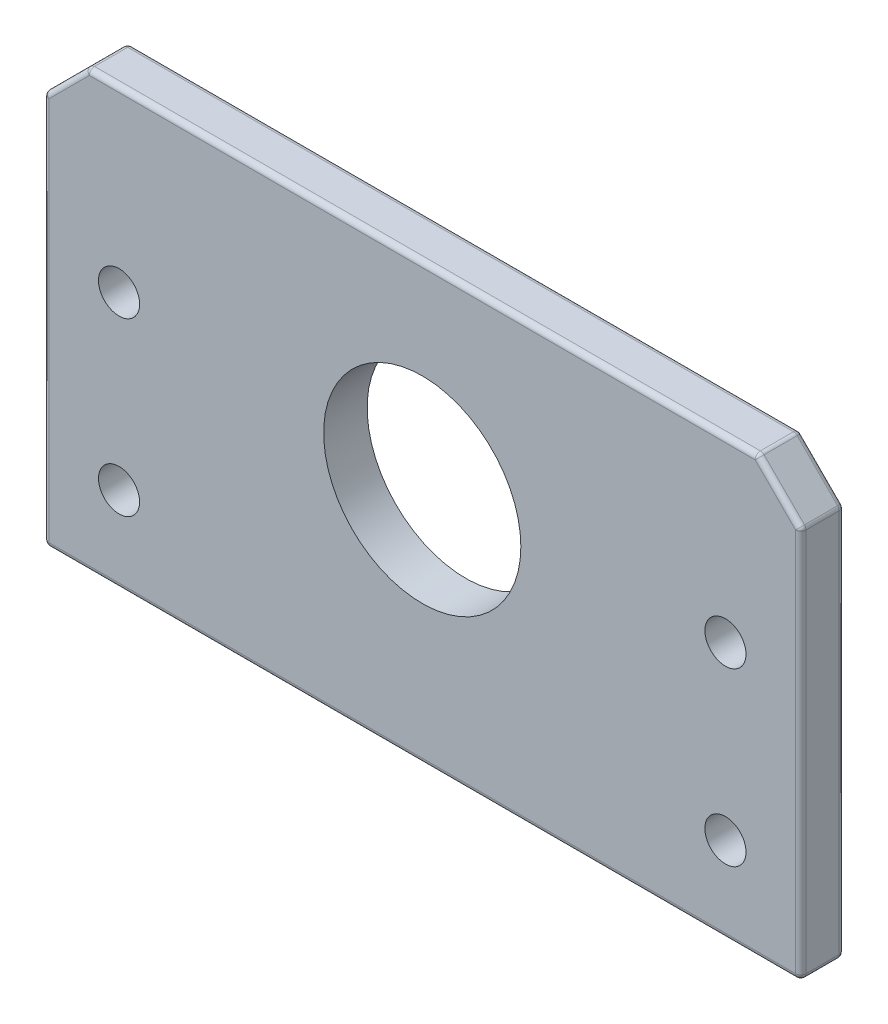
from build123d import *

# Parameters (mm, degrees)
SKETCH2_W                   = 110.49
SKETCH2_H                   = 6.35
BOSS_EXTRUDE1_DEPTH         = 63.5
SKETCH3_R                   = 14.3891
CUT_EXTRUDE1_DEPTH          = 85.407242136
CHAMFER1_SIZE               = 6.35
TAP_DRILL_FOR_M7X1_0_TAP1_D = 6
FILLET2_R                   = 0.762


with BuildPart() as part:
    # Sketch2 → Boss-Extrude1 (new body)
    with BuildSketch(Plane(origin=(0, 0, 0), x_dir=(1, 0, 0), z_dir=(0, 1, 0))):
        Rectangle(SKETCH2_W, SKETCH2_H)
    extrude(amount=-BOSS_EXTRUDE1_DEPTH)

    # Sketch3 → Cut-Extrude1 (cut, through all)
    with BuildSketch(Plane.XY.offset(3.175)):
        with Locations((0, -28.8150046)):
            Circle(SKETCH3_R)
    extrude(amount=-CUT_EXTRUDE1_DEPTH, mode=Mode.SUBTRACT)

    # Chamfer1
    chamfer1_edges = [part.edges().sort_by_distance(p)[0] for p in [
        (55.245, 0, 0),
        (-55.245, 0, 0),
    ]]
    chamfer(chamfer1_edges, length=CHAMFER1_SIZE)

    # Tap Drill for M7x1.0 Tap1 (through all)
    with Locations(Plane(origin=(0, 0, -3.175), x_dir=(-1, 0, 0), z_dir=(0, 0, -1))):
        with Locations((44.245, -26), (44.245, -51), (-44.245, -51), (-44.245, -26)):
            Hole(TAP_DRILL_FOR_M7X1_0_TAP1_D / 2)

    # Fillet2
    fillet2_edges = [part.edges().sort_by_distance(p)[0] for p in [
        (55.245, -63.5, 0),
        (0, -63.5, -3.175),
        (0, 0, 3.175),
        (0, 0, -3.175),
        (48.895, 0, 0),
        (-48.895, 0, 0),
        (52.07, -3.175, 3.175),
        (-52.07, -3.175, 3.175),
        (-55.245, -6.35, 0),
        (52.07, -3.175, -3.175),
        (-52.07, -3.175, -3.175),
        (55.245, -6.35, 0),
        (-55.245, -63.5, 0),
        (-55.245, -34.925, -3.175),
        (55.245, -34.925, -3.175),
        (55.245, -34.925, 3.175),
        (-55.245, -34.925, 3.175),
        (0, -63.5, 3.175),
    ]]
    fillet(fillet2_edges, radius=FILLET2_R)


solid = part.part
